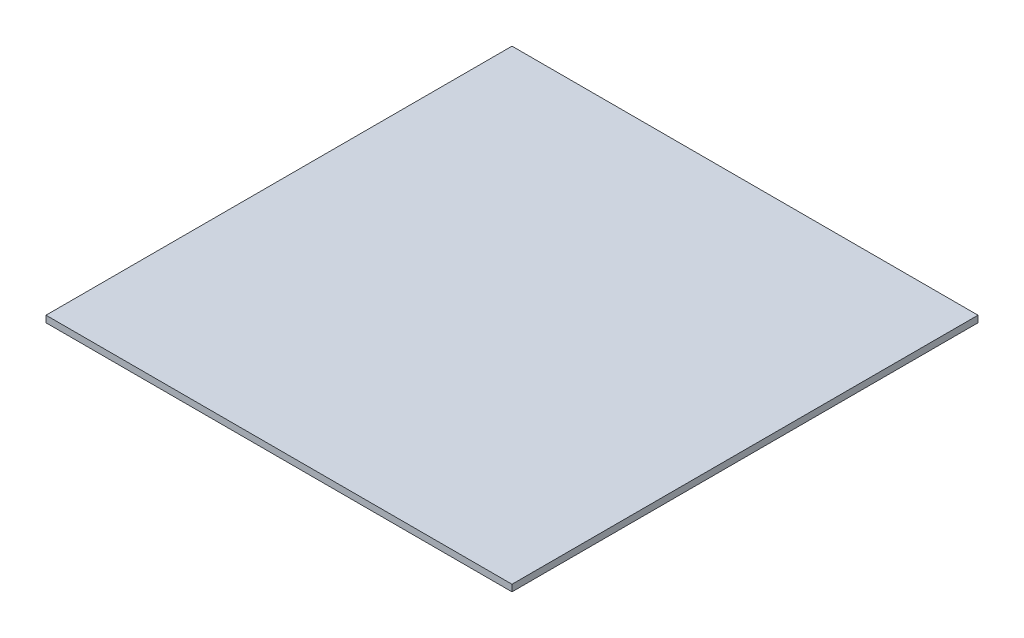
from build123d import *

# Parameters (mm, degrees)
SKETCH1_W           = 100
SKETCH1_H           = 100
BOSS_EXTRUDE1_DEPTH = 0.71


with BuildPart() as part:
    # Sketch1 → Boss-Extrude1 (new, symmetric)
    with BuildSketch(Plane(origin=(0, 0, 0), x_dir=(1, 0, 0), z_dir=(0, 1, 0))):
        Rectangle(SKETCH1_W, SKETCH1_H)
    extrude(amount=BOSS_EXTRUDE1_DEPTH, both=True)


solid = part.part
